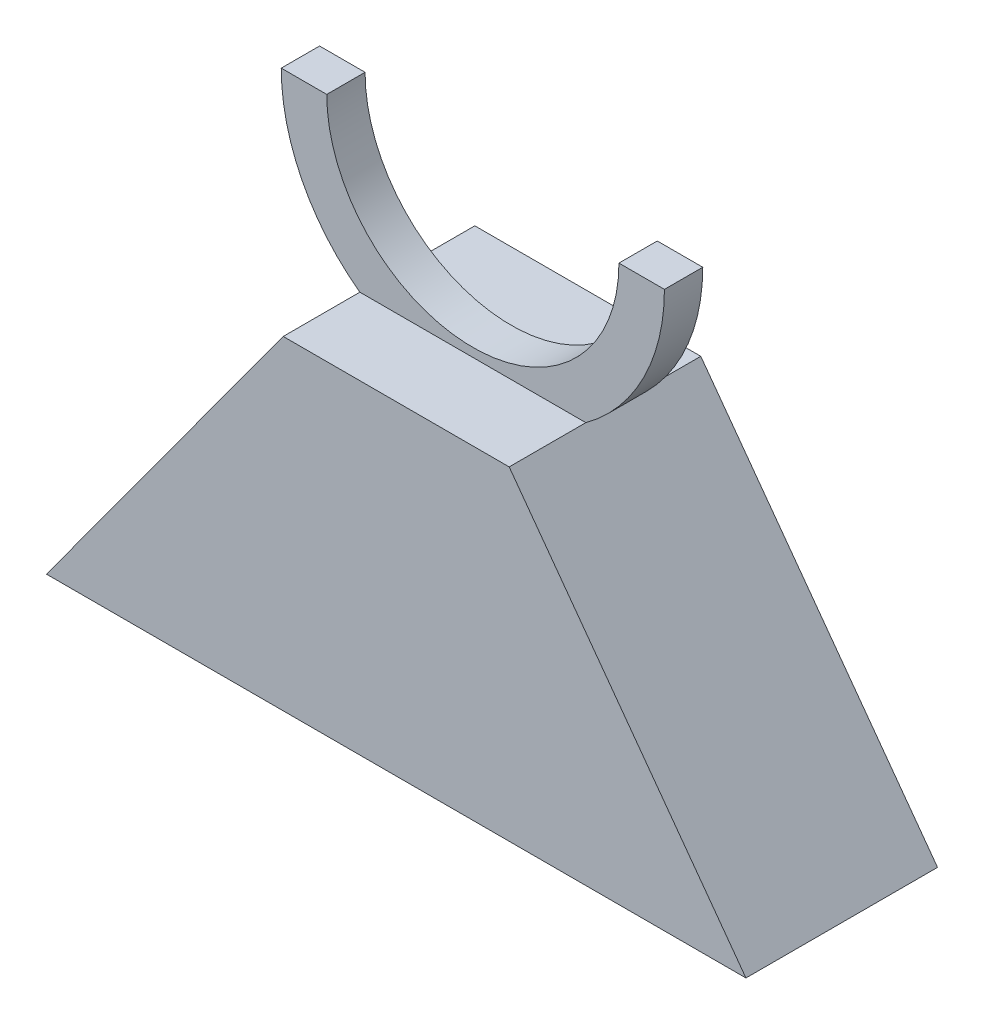
from build123d import *

# Parameters (mm, degrees)
BOSS_EXTRU_1_DEPTH      = 2
BOSS_EXTRU_1_DEPTH_BACK = 2
BOSS_EXTRU_3_DEPTH      = 10
BOSS_EXTRU_3_DEPTH_BACK = 10


with BuildPart() as part:
    # Esquisse1 → Boss.-Extru.1 (new, two sides: drawn at the far end of the back side and taken through both)
    with BuildSketch(Plane.XY.offset(-BOSS_EXTRU_1_DEPTH_BACK)):
        with BuildLine():
            Line((-20, 0), (-15.25, 0))
            ThreePointArc((-15.25, 0), (0, -15.25), (15.25, 0))
            Line((15.25, 0), (20, 0))
            ThreePointArc((20, 0), (0, -20), (-20, 0))
        make_face()
    extrude(amount=BOSS_EXTRU_1_DEPTH + BOSS_EXTRU_1_DEPTH_BACK)

    # Esquisse2 → Boss.-Extru.3 (add, two sides: drawn at the far end of the back side and taken through both)
    with BuildSketch(Plane.XY.offset(-BOSS_EXTRU_3_DEPTH_BACK)):
        Polygon((-11.79408626, -16.152384632), (-36.508808232, -50), (36.508808232, -50), (11.79408626, -16.152384632), align=None)
    extrude(amount=BOSS_EXTRU_3_DEPTH + BOSS_EXTRU_3_DEPTH_BACK)


solid = part.part
